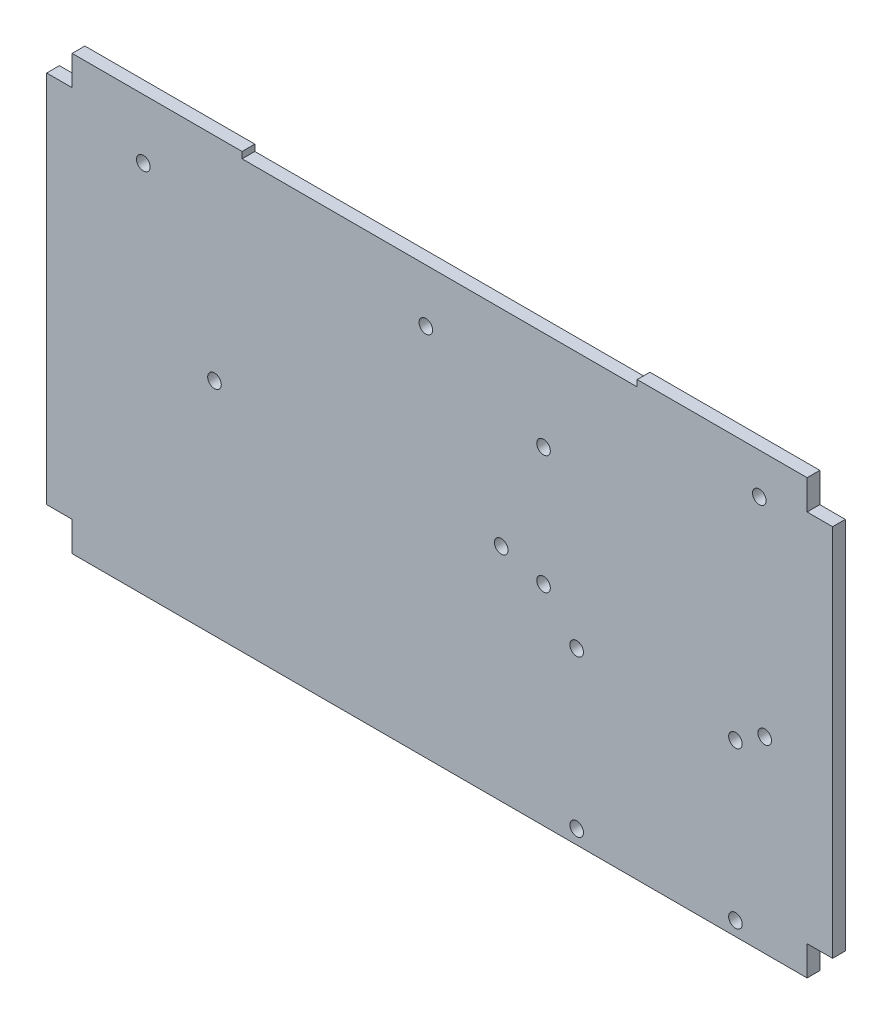
from build123d import *

# Parameters (mm, degrees)
EXTRUDE_1_DEPTH     = 3
HOLE_WIZARD_M31_D   = 3.2
SKETCH_6_W          = 6.5
SKETCH_6_H          = 7
CUT_EXTRUDE_1_DEPTH = 106.670478375
SKETCH_7_W          = 93
SKETCH_7_H          = 1.5
CUT_EXTRUDE_2_DEPTH = 106.670478375


with BuildPart() as part:
    # Эскиз1 → Бобышка-Вытянуть1 (new body)
    with BuildSketch(Plane.XY):
        with BuildLine():
            Line((92.5, -51), (92.5, -48.698957881))
            ThreePointArc((92.5, -48.698957881), (86.75, -47.5), (92.5, -46.301042119))
            Line((92.5, -46.301042119), (92.5, 46.301042119))
            ThreePointArc((92.5, 46.301042119), (86.75, 47.5), (92.5, 48.698957881))
            Line((92.5, 48.698957881), (92.5, 51))
            Line((92.5, 51), (-92.5, 51))
            Line((-92.5, 51), (-92.5, 48.698957881))
            ThreePointArc((-92.5, 48.698957881), (-86.75, 47.5), (-92.5, 46.301042119))
            Line((-92.5, 46.301042119), (-92.5, -46.301042119))
            ThreePointArc((-92.5, -46.301042119), (-86.75, -47.5), (-92.5, -48.698957881))
            Line((-92.5, -48.698957881), (-92.5, -51))
            Line((-92.5, -51), (92.5, -51))
        make_face()
    extrude(amount=EXTRUDE_1_DEPTH)

    # Отверстие с зазором M31 (through all)
    with Locations(Plane(origin=(0, 0, 0), x_dir=(-1, 0, 0), z_dir=(0, 0, -1))):
        with Locations((-76.53, -6.8), (-24.46, -1.72), (-24.46, 26.22), (-75.26, 41.46), (-69.63631327, -47.68571173), (-69.63631327, -10.94391141), (-32.25681239, -10.94391141), (-32.25681239, -47.68571173), (-14.5, 1), (53, 1), (3.25, 37), (69.75, 37)):
            Hole(HOLE_WIZARD_M31_D / 2)

    # Эскиз6 → Вырез-Вытянуть1 (cut, through all)
    with BuildSketch(Plane(origin=(0, 0, 0), x_dir=(-1, 0, 0), z_dir=(0, 0, -1))):
        with Locations((-89.75, 47.5)):
            Rectangle(SKETCH_6_W, SKETCH_6_H)
        with Locations((89.75, 47.5)):
            Rectangle(SKETCH_6_W, SKETCH_6_H)
        with Locations((89.75, -47.5)):
            Rectangle(SKETCH_6_W, SKETCH_6_H)
        with Locations((-89.75, -47.5)):
            Rectangle(SKETCH_6_W, SKETCH_6_H)
    extrude(amount=-CUT_EXTRUDE_1_DEPTH, mode=Mode.SUBTRACT)

    # Эскиз7 → Вырез-Вытянуть2 (cut, through all)
    with BuildSketch(Plane(origin=(0, 0, 0), x_dir=(-1, 0, 0), z_dir=(0, 0, -1))):
        with Locations((0, 50.25)):
            Rectangle(SKETCH_7_W, SKETCH_7_H)
    extrude(amount=-CUT_EXTRUDE_2_DEPTH, mode=Mode.SUBTRACT)


solid = part.part
